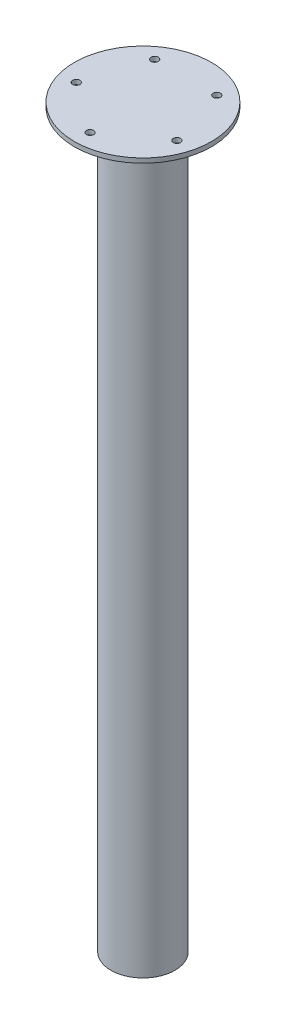
from build123d import *

# Parameters (mm, degrees)
SKETCH1_R                = 35
BOSS_EXTRUDE1_DEPTH      = 800
SKETCH2_R                = 75
BOSS_EXTRUDE2_DEPTH      = 5
FILLET1_R                = 10
F_8_0_8_DIAMETER_HOLE1_D = 8
CIRPATTERN1_COUNT        = 5


with BuildPart() as part:
    # Sketch1 → Boss-Extrude1 (new body)
    with BuildSketch(Plane(origin=(0, 0, 0), x_dir=(1, 0, 0), z_dir=(0, 1, 0))):
        with Locations(Location((0, 0, 0), (0, 0, 270))):
            Circle(SKETCH1_R)
    extrude(amount=BOSS_EXTRUDE1_DEPTH)

    # Sketch2 → Boss-Extrude2 (add)
    with BuildSketch(Plane(origin=(0, 800, 0), x_dir=(1, 0, 0), z_dir=(0, 1, 0))):
        with Locations(Location((0, 0, 0), (0, 0, 270))):
            Circle(SKETCH2_R)
    extrude(amount=BOSS_EXTRUDE2_DEPTH)

    # Fillet1
    fillet1_edges = [part.edges().sort_by_distance(p)[0] for p in [
        (0, 800, -35),
    ]]
    fillet(fillet1_edges, radius=FILLET1_R)

    # Ø8.0 (8) Diameter Hole1 (through all)
    with Locations(Plane(origin=(0, 805, 0), x_dir=(1, 0, 0), z_dir=(0, 1, 0))):
        with Locations((0, -57.858005833)):
            f_8_0_8_diameter_hole1 = Hole(F_8_0_8_DIAMETER_HOLE1_D / 2)

    # CirPattern1: Ø8.0 (8) Diameter Hole1 ×5 about axis
    cirpattern1_axis = Axis((0, 0, 0), (0, 1, 0))
    for i in range(1, CIRPATTERN1_COUNT):
        add(f_8_0_8_diameter_hole1.rotate(cirpattern1_axis, i * 360 / CIRPATTERN1_COUNT), mode=Mode.SUBTRACT)


solid = part.part
